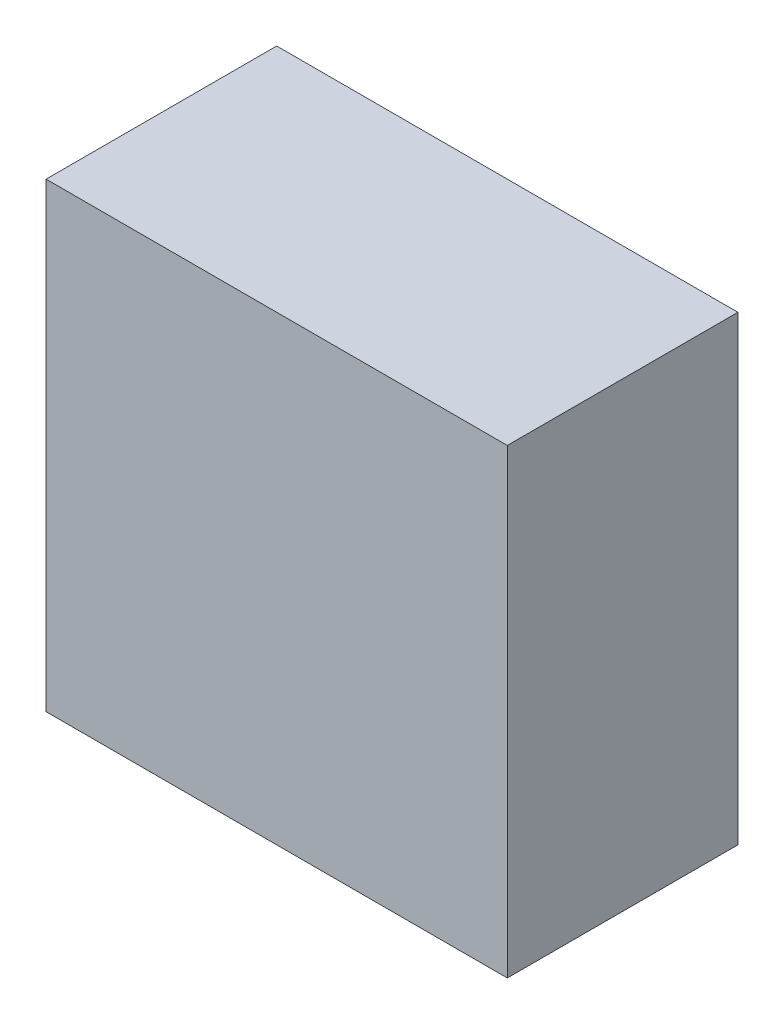
from build123d import *

# Parameters (mm, degrees)
SKETCH_1_W      = 40000
SKETCH_1_H      = 40000
EXTRUDE_1_DEPTH = 20000


with BuildPart() as part:
    # 草图1 → 凸台-拉伸1 (new body)
    with BuildSketch(Plane.XY):
        with Locations((20000, 20000)):
            Rectangle(SKETCH_1_W, SKETCH_1_H)
    extrude(amount=-EXTRUDE_1_DEPTH)


solid = part.part
